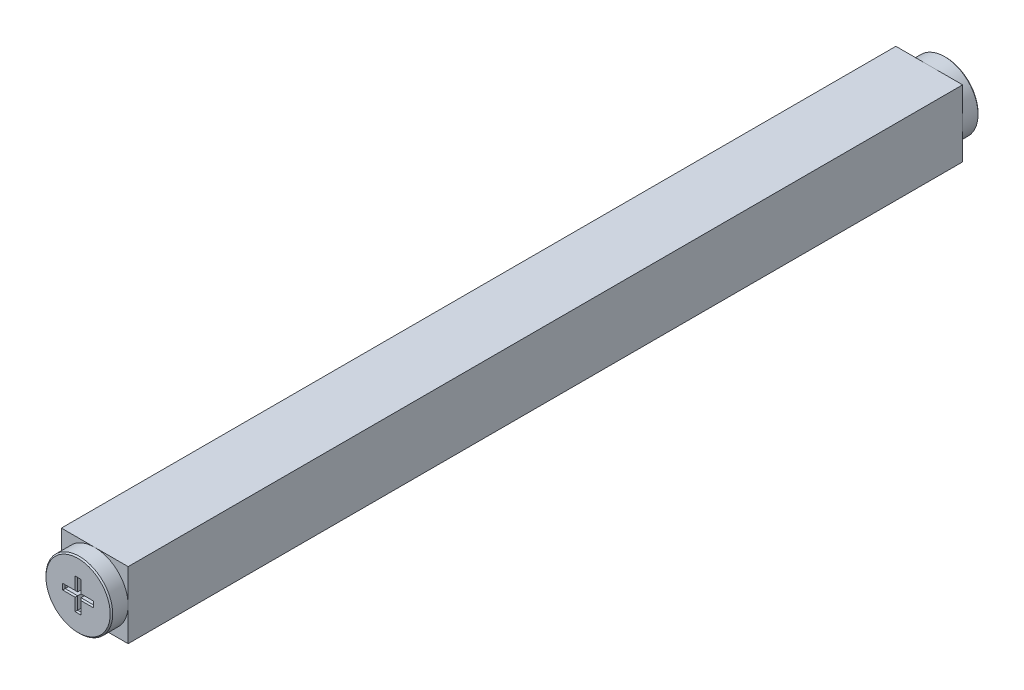
from build123d import *

# Parameters (mm, degrees)
SKETCH1_W           = 8
SKETCH1_H           = 8
BOSS_EXTRUDE1_DEPTH = 50
SKETCH2_R           = 4
BOSS_EXTRUDE2_DEPTH = 2
CUT_EXTRUDE1_DEPTH  = 2
CHAMFER2_SIZE       = 0.15


with BuildPart() as part:
    # Sketch1 → Boss-Extrude1 (new body)
    with BuildSketch(Plane.XY):
        with Locations((4, 4)):
            Rectangle(SKETCH1_W, SKETCH1_H)
    boss_extrude1 = extrude(amount=BOSS_EXTRUDE1_DEPTH)

    # Sketch2 → Boss-Extrude2 (add)
    with BuildSketch(Plane.XY.offset(50)):
        with Locations((4, 4)):
            Circle(SKETCH2_R)
    boss_extrude2 = extrude(amount=BOSS_EXTRUDE2_DEPTH)

    # Mirror1: Boss-Extrude1, Boss-Extrude2 across Front Plane
    add(boss_extrude1.mirror(Plane.XY))
    add(boss_extrude2.mirror(Plane.XY))

    # Sketch3 → Cut-Extrude1 (cut)
    with BuildSketch(Plane.XY.offset(52)):
        Polygon((3.8, 5.7), (4.2, 5.7), (4.2, 4.2), (5.7, 4.2), (5.7, 3.8), (4.2, 3.8), (4.2, 2.3), (3.8, 2.3), (3.8, 3.8), (2.3, 3.8), (2.3, 4.2), (3.8, 4.2), align=None)
    cut_extrude1 = extrude(amount=-CUT_EXTRUDE1_DEPTH, mode=Mode.SUBTRACT)

    # Mirror3: Cut-Extrude1 across plane
    add(cut_extrude1.mirror(Plane.XY), mode=Mode.SUBTRACT)

    # Chamfer2
    chamfer2_edges = [part.edges().sort_by_distance(p)[0] for p in [
        (0, 4, 52),
        (0, 4, -52),
        (4, 5.7, 52),
        (4.2, 4.95, 52),
        (4.95, 4.2, 52),
        (5.7, 4, 52),
        (3.8, 3.05, 52),
        (3.05, 3.8, 52),
        (3.8, 4.95, 52),
        (3.05, 4.2, 52),
        (2.3, 4, 52),
        (4, 2.3, 52),
        (4.2, 3.05, 52),
        (4.95, 3.8, 52),
        (3.8, 4.95, -52),
        (3.05, 4.2, -52),
        (2.3, 4, -52),
        (4, 2.3, -52),
        (4.2, 3.05, -52),
        (4.95, 3.8, -52),
        (4, 5.7, -52),
        (4.2, 4.95, -52),
        (4.95, 4.2, -52),
        (5.7, 4, -52),
        (3.8, 3.05, -52),
        (3.05, 3.8, -52),
    ]]
    chamfer(chamfer2_edges, length=CHAMFER2_SIZE)


solid = part.part
